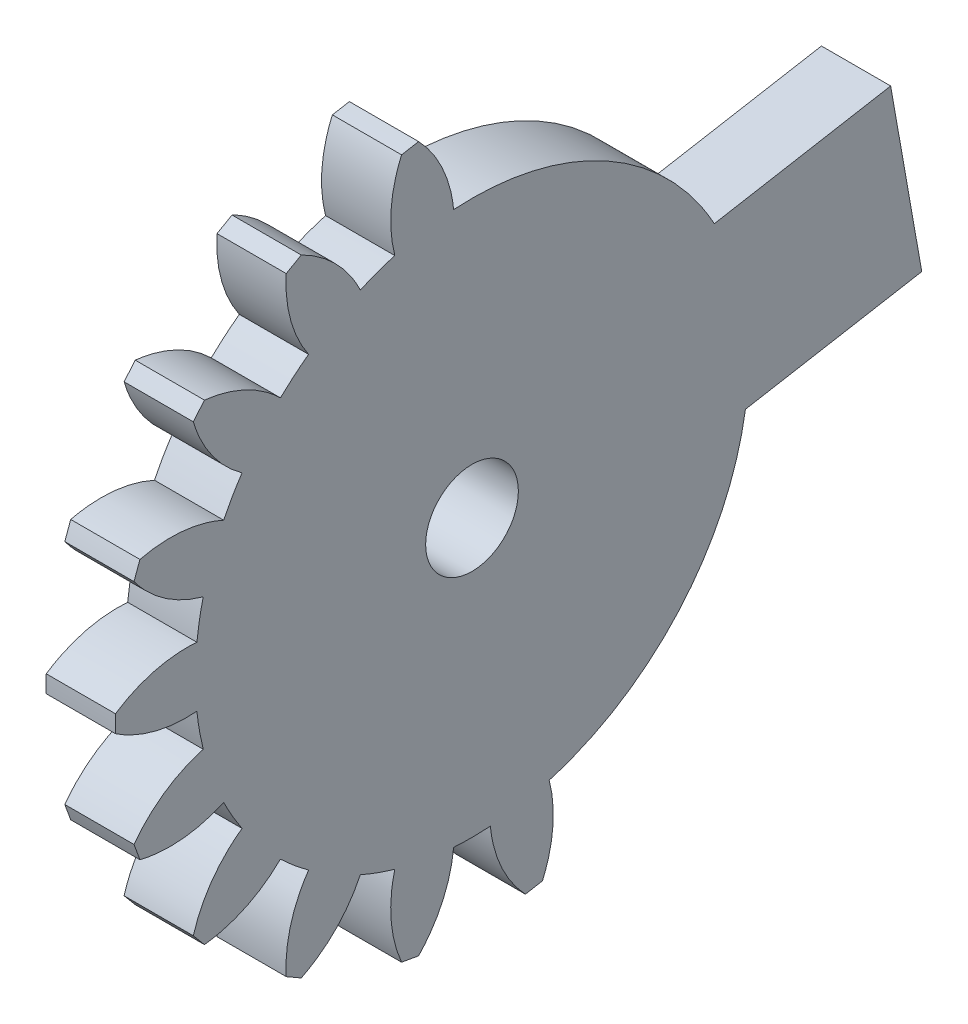
from build123d import *

# Parameters (mm, degrees)
BASPROSKE_W                  = 3.175
BASPROSKE_H                  = 12.7
TOOTHCUT_DEPTH               = 19.238986403
TEETHCUTS_COUNT              = 18
TEETHCUTS_ANGLE              = 340
BORSKE_R                     = 1.5875
BORE_DEPTH                   = 50.8000508
CUT_EXTRUDE_THIN1_DEPTH      = 2.54
CUT_EXTRUDE_THIN1_DEPTH_BACK = 5.08
BOSS_EXTRUDE1_DEPTH          = 3.175
SKETCH9_R                    = 1.651
CUT_EXTRUDE2_DEPTH           = 3.175
SCALE1_SCALE_X               = 1
SCALE1_SCALE_Y               = 1.288
SCALE1_SCALE_Z               = 1.288


with BuildPart() as part:
    # BasProSke → Base-Revolve (revolve)
    with BuildSketch(Plane(origin=(0, 0, 0), x_dir=(1, 0, 0), z_dir=(0, 1, 0)), mode=Mode.PRIVATE) as base_revolve_sk:
        with Locations((1.5875, 6.35)):
            Rectangle(BASPROSKE_W, BASPROSKE_H)
    revolve(base_revolve_sk.sketch.rotate(Axis((-10, 0, 0), (1, 0, 0)), 180), axis=Axis((-10, 0, 0), (1, 0, 0)))

    # TooCutSke → ToothCut (cut, through all)
    with BuildSketch(Plane(origin=(0, 0, 0), x_dir=(0, 0, -1), z_dir=(1, 0, 0))):
        with BuildLine():
            ThreePointArc((0.653663469, 9.833498417), (0, 9.8552), (-0.653663469, 9.833498417))
            ThreePointArc((-0.653663469, 9.833498417), (-1.05484238, 11.314407704), (-1.923354389, 12.579209556))
            ThreePointArc((-1.923354389, 12.579209556), (0, 12.7254), (1.923354389, 12.579209556))
            ThreePointArc((1.923354389, 12.579209556), (1.05484238, 11.314407704), (0.653663469, 9.833498417))
        make_face()
    toothcut = extrude(amount=TOOTHCUT_DEPTH, mode=Mode.SUBTRACT)

    # TeethCuts: ToothCut ×18 about axis
    teethcuts_axis = Axis((-10, 0, 0), (1, 0, 0))
    for i in range(1, TEETHCUTS_COUNT):
        add(toothcut.rotate(teethcuts_axis, i * TEETHCUTS_ANGLE / (TEETHCUTS_COUNT - 1)), mode=Mode.SUBTRACT)

    # BorSke → Bore (cut, symmetric)
    with BuildSketch(Plane(origin=(0, 0, 0), x_dir=(0, 0, -1), z_dir=(1, 0, 0))):
        with Locations(Location((0, 0, 0), (0, 0, 180))):
            Circle(BORSKE_R)
    extrude(amount=BORE_DEPTH, both=True, mode=Mode.SUBTRACT)

    # Sketch7 → Cut-Extrude-Thin1 (cut, two sides: drawn at the far end of the back side and taken through both)
    with BuildSketch(Plane.ZY.offset(-CUT_EXTRUDE_THIN1_DEPTH_BACK)):
        with BuildLine():
            Line((-10.81342685, 10.301941507), (-19.029445708, 11.750647305))
            Line((-19.029445708, 11.750647305), (-21.900787785, -4.533542814))
            Line((-21.900787785, -4.533542814), (-13.684768927, -5.982248613))
            ThreePointArc((-13.684768927, -5.982248613), (-11.777730795, -9.183967354), (-9.137407483, -11.813889433))
            Line((-9.137407483, -11.813889433), (-10.123749891, -15.359323522))
            ThreePointArc((-10.123749891, -15.359323522), (18.075950353, -3.414549717), (-3.823316016, 17.993926352))
            Line((-3.823316016, 17.993926352), (-4.429973276, 14.26308297))
            ThreePointArc((-4.429973276, 14.26308297), (-7.874831571, 12.690438399), (-10.81342685, 10.301941507))
        make_face()
        with BuildLine():
            Line((-8.630211716, 4.758614586), (-14.908755065, 5.865691177))
            Line((-14.908755065, 5.865691177), (-16.015831657, -0.412852171))
            Line((-16.015831657, -0.412852171), (-9.737288308, -1.519928763))
            ThreePointArc((-9.737288308, -1.519928763), (-7.54470959, -6.340530281), (-3.17353646, -9.330253661))
            Line((-3.17353646, -9.330253661), (-4.102105036, -12.668018169))
            ThreePointArc((-4.102105036, -12.668018169), (13.106078775, -2.353008543), (0.560765244, 13.303814957))
            Line((0.560765244, 13.303814957), (0, 9.8552))
            ThreePointArc((0, 9.8552), (-5.011380477, 8.48593146), (-8.630211716, 4.758614586))
        make_face(mode=Mode.SUBTRACT)
    extrude(amount=CUT_EXTRUDE_THIN1_DEPTH + CUT_EXTRUDE_THIN1_DEPTH_BACK, mode=Mode.SUBTRACT)

    # Sketch8 → Boss-Extrude1 (add)
    with BuildSketch(Plane.ZY):
        Polygon((-14.908755065, 5.865691177), (-16.015831657, -0.412852171), (-9.737288308, -1.519928763), (-8.630211716, 4.758614586), align=None)
    extrude(amount=-BOSS_EXTRUDE1_DEPTH)

    # Sketch9 → Cut-Extrude2 (cut)
    with BuildSketch(Plane.ZY):
        Circle(SKETCH9_R)
    extrude(amount=-CUT_EXTRUDE2_DEPTH, mode=Mode.SUBTRACT)


with BuildPart() as part_1:
    # Scale1: scaled about (1.5875, 0.080984297, -0.459284773)
    add(part.part.scale((SCALE1_SCALE_X, SCALE1_SCALE_Y, SCALE1_SCALE_Z), about=(1.5875, 0.080984297, -0.459284773)))


solid = part_1.part
